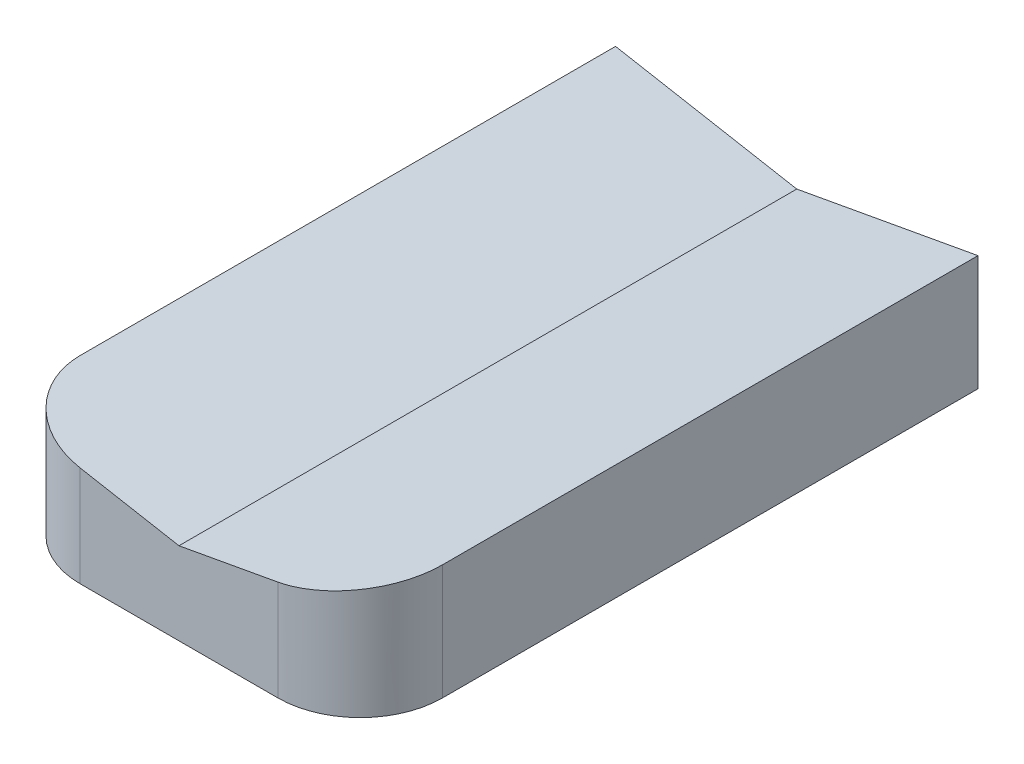
from build123d import *

# Parameters (mm, degrees)
EXTRUDE_2_DEPTH     = 7
CUT_EXTRUDE_1_DEPTH = 40.702015062


with BuildPart() as part:
    # 草图1 → 凸台-拉伸2 (new body)
    with BuildSketch(Plane.XZ):
        with BuildLine():
            Line((6, 37.5), (-6, 37.5))
            ThreePointArc((-6, 37.5), (-9.535533906, 36.035533906), (-11, 32.5))
            Line((-11, 32.5), (-11, 0))
            Line((-11, 0), (11, 0))
            Line((11, 0), (11, 32.5))
            ThreePointArc((11, 32.5), (9.535533906, 36.035533906), (6, 37.5))
        make_face()
    extrude(amount=EXTRUDE_2_DEPTH)

    # 草图2 → 切除-拉伸1 (cut, through all)
    with BuildSketch(Plane(origin=(0, 0, 0), x_dir=(-1, 0, 0), z_dir=(0, 0, -1))):
        Polygon((-11, 0), (11, 0), (0, -2), align=None)
    extrude(amount=-CUT_EXTRUDE_1_DEPTH, mode=Mode.SUBTRACT)


solid = part.part
